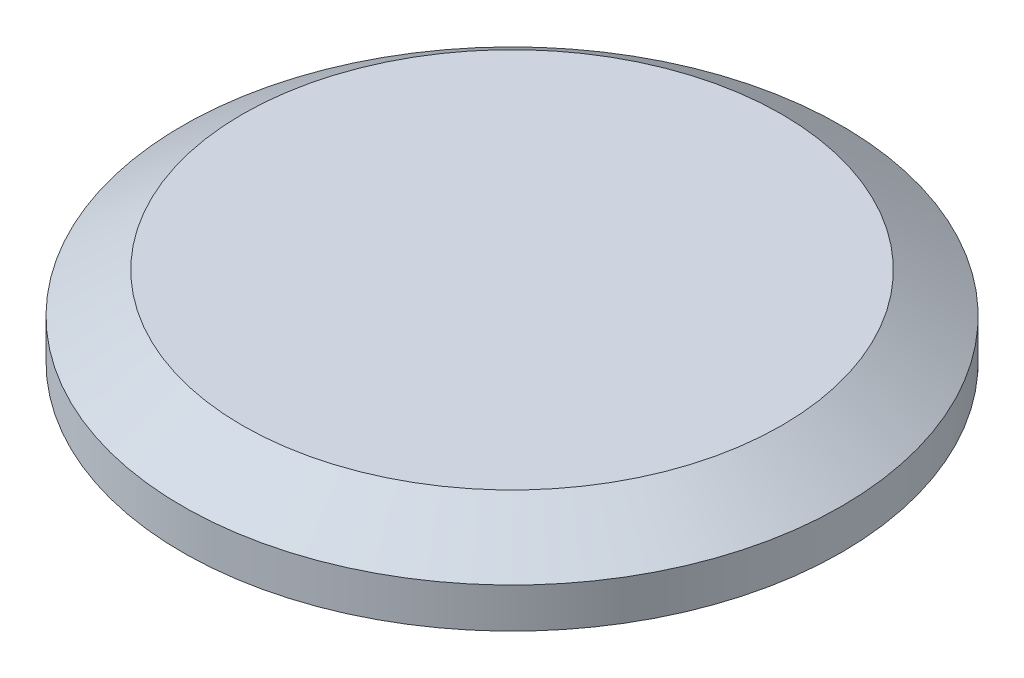
from build123d import *


with BuildPart() as part:
    # Эскиз1 → Повернуть1 (revolve)
    with BuildSketch(Plane.XY, mode=Mode.PRIVATE) as revolve_1_sk:
        Polygon((0, 0), (-3, 0), (-3, 9), (-13.5, 9), (-16.5, 7), (-16.5, 9), (-13.5, 11), (0, 11), align=None)
    revolve(revolve_1_sk.sketch.rotate(Axis((0, 0, 0), (0, 1, 0)), 180), axis=Axis((0, 0, 0), (0, 1, 0)))


solid = part.part
